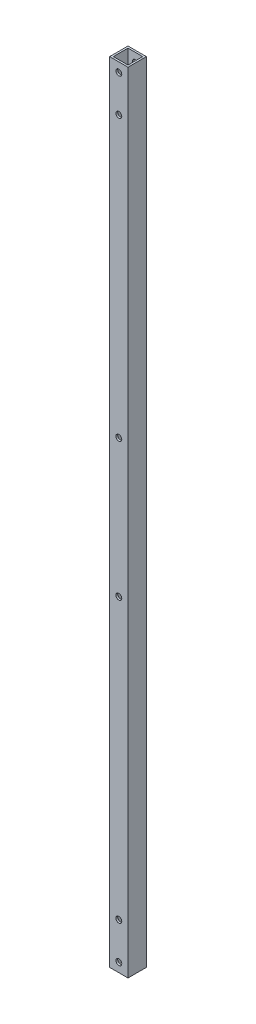
from build123d import *

# Parameters (mm, degrees)
SKETCH_1_W          = 10
SKETCH_1_H          = 10
SKETCH_1_W_2        = 8
SKETCH_1_H_2        = 8
EXTRUDE_1_DEPTH     = 214.97
SKETCH_2_R          = 1.6
CUT_EXTRUDE_1_DEPTH = 213.715
SKETCH_3_R          = 1.6
CUT_EXTRUDE_2_DEPTH = 10


with BuildPart() as part:
    # ｽｹｯﾁ1 → ﾎﾞｽ - 押し出し1 (new, symmetric)
    with BuildSketch(Plane(origin=(0, 0, 0), x_dir=(1, 0, 0), z_dir=(0, 1, 0))):
        Rectangle(SKETCH_1_W, SKETCH_1_H)
        Rectangle(SKETCH_1_W_2, SKETCH_1_H_2, mode=Mode.SUBTRACT)
    extrude(amount=EXTRUDE_1_DEPTH, both=True)

    # ｽｹｯﾁ2 → ｶｯﾄ - 押し出し1 (cut, symmetric)
    with BuildSketch(Plane.XY.offset(5)):
        with Locations((0, 209.97)):
            Circle(SKETCH_2_R)
        with Locations((0, 189.97)):
            Circle(SKETCH_2_R)
    cut_extrude_1 = extrude(amount=CUT_EXTRUDE_1_DEPTH, both=True, mode=Mode.SUBTRACT)

    # ﾐﾗｰ1: ｶｯﾄ - 押し出し1 across plane
    add(cut_extrude_1.mirror(Plane.ZX), mode=Mode.SUBTRACT)

    # ｽｹｯﾁ3 → ｶｯﾄ - 押し出し2 (cut)
    with BuildSketch(Plane(origin=(0, 0, -5), x_dir=(-1, 0, 0), z_dir=(0, 0, -1))):
        with Locations((0, 37.5)):
            Circle(SKETCH_3_R)
        with Locations((0, -37.5)):
            Circle(SKETCH_3_R)
    extrude(amount=-CUT_EXTRUDE_2_DEPTH, mode=Mode.SUBTRACT)


solid = part.part
